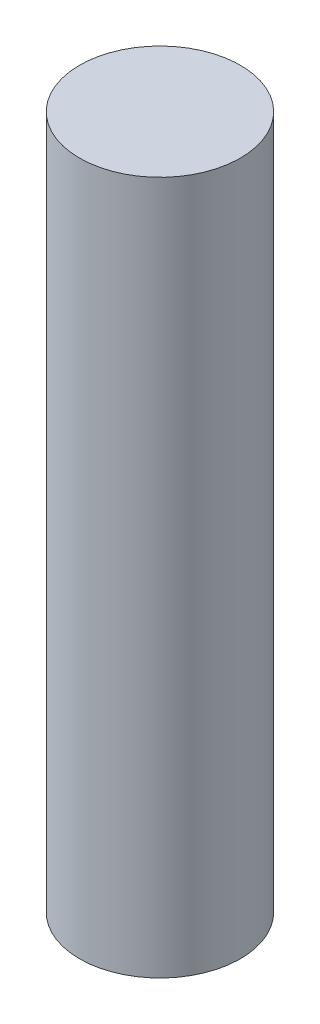
from build123d import *

# Parameters (mm, degrees)
SKETCH1_R           = 4.9875
BOSS_EXTRUDE1_DEPTH = 43


with BuildPart() as part:
    # Sketch1 → Boss-Extrude1 (new body)
    with BuildSketch(Plane(origin=(0, 0, 0), x_dir=(1, 0, 0), z_dir=(0, 1, 0))):
        with Locations(Location((0, 0, 0), (0, 0, 270))):
            Circle(SKETCH1_R)
    extrude(amount=BOSS_EXTRUDE1_DEPTH)


solid = part.part
